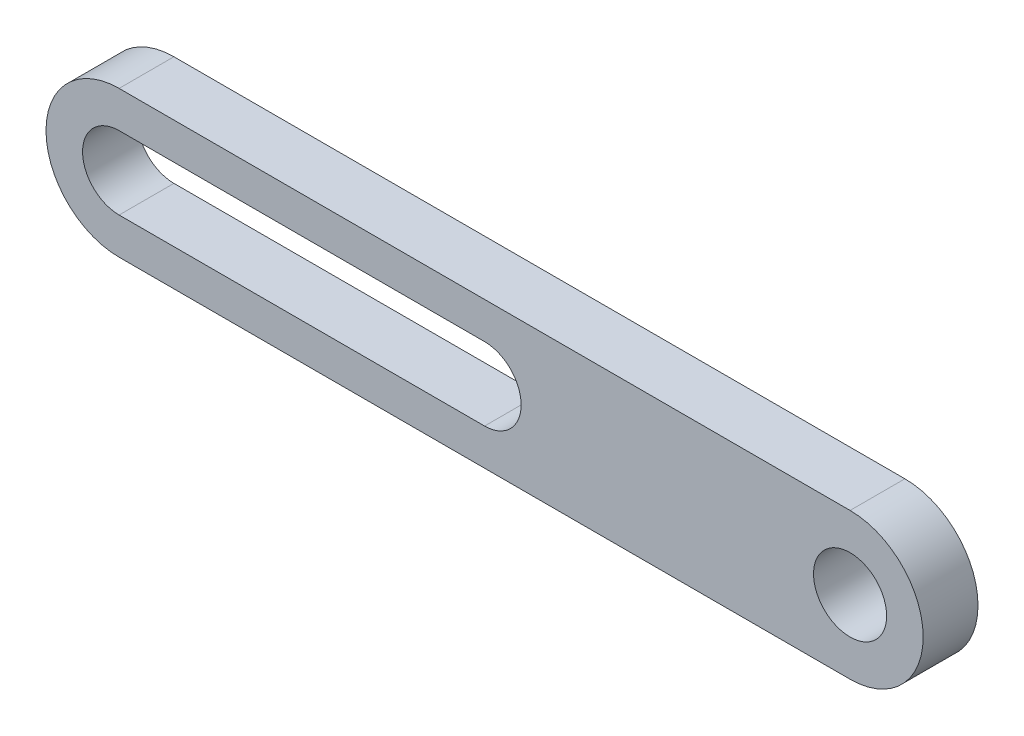
from build123d import *

# Parameters (mm, degrees)
SKETCH1_R           = 1
BOSS_EXTRUDE1_DEPTH = 1.5


with BuildPart() as part:
    # Sketch1 → Boss-Extrude1 (new body)
    with BuildSketch(Plane.XY):
        with BuildLine():
            Line((-10, 2), (10, 2))
            ThreePointArc((10, 2), (12, 0), (10, -2))
            Line((10, -2), (-10, -2))
            ThreePointArc((-10, -2), (-12, 0), (-10, 2))
        make_face()
        with Locations((10, 0)):
            Circle(SKETCH1_R, mode=Mode.SUBTRACT)
        with BuildLine():
            Line((-10, 1), (0, 1))
            ThreePointArc((0, 1), (1, 0), (0, -1))
            Line((0, -1), (-10, -1))
            ThreePointArc((-10, -1), (-11, 0), (-10, 1))
        make_face(mode=Mode.SUBTRACT)
    extrude(amount=BOSS_EXTRUDE1_DEPTH)


solid = part.part
